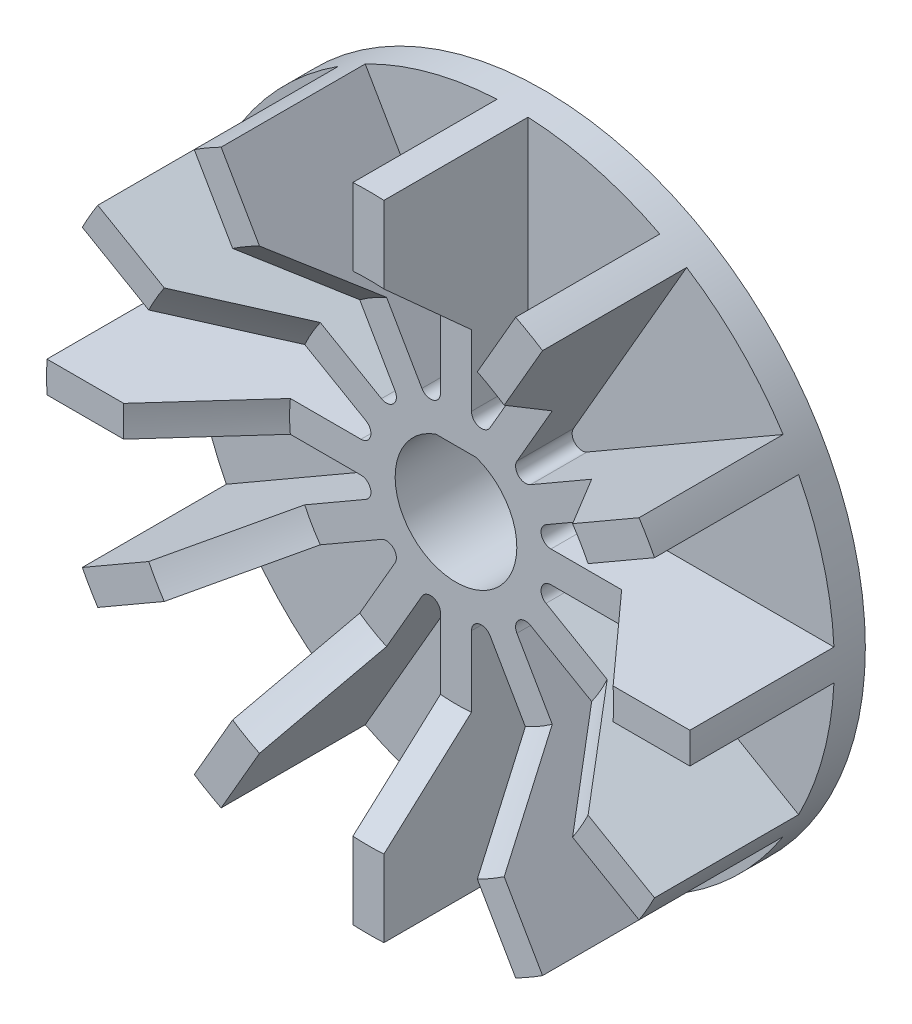
from build123d import *

# Parameters (mm, degrees)
SKETCH1_R           = 46.6725
BOSS_EXTRUDE1_DEPTH = 4.5
BOSS_EXTRUDE2_START = -4.5
BOSS_EXTRUDE2_DEPTH = 25.4


with BuildPart() as part:
    # Sketch1 → Boss-Extrude1 (new body)
    with BuildSketch(Plane.XY):
        Circle(SKETCH1_R)
        with BuildLine():
            Line((-2.927883194, 8.3225), (2.927883194, 8.3225))
            ThreePointArc((2.927883194, 8.3225), (0, -8.8225), (-2.927883194, 8.3225))
        make_face(mode=Mode.SUBTRACT)
    extrude(amount=BOSS_EXTRUDE1_DEPTH)

    # Sketch2 → Boss-Extrude2 (add)
    with BuildSketch(Plane.XY.offset(4.5).offset(BOSS_EXTRUDE2_START)):
        with BuildLine():
            Line((-2.25, 46.618234161), (-2.25, 13.778350254))
            ThreePointArc((-2.25, 13.778350254), (-3.318707206, 12.385583908), (-4.940617969, 13.057401343))
            Line((-4.940617969, 13.057401343), (-21.360559922, 41.497575063))
            ThreePointArc((-21.360559922, 41.497575063), (-23.33625, 40.419570658), (-25.257674239, 39.247575063))
            Line((-25.257674239, 39.247575063), (-8.837732286, 10.807401343))
            ThreePointArc((-8.837732286, 10.807401343), (-9.066876702, 9.066876702), (-10.807401343, 8.837732286))
            Line((-10.807401343, 8.837732286), (-39.247575063, 25.257674239))
            ThreePointArc((-39.247575063, 25.257674239), (-40.419570658, 23.33625), (-41.497575063, 21.360559922))
            Line((-41.497575063, 21.360559922), (-13.057401343, 4.940617969))
            ThreePointArc((-13.057401343, 4.940617969), (-12.385583908, 3.318707206), (-13.778350254, 2.25))
            Line((-13.778350254, 2.25), (-46.618234161, 2.25))
            ThreePointArc((-46.618234161, 2.25), (-46.6725, 0), (-46.618234161, -2.25))
            Line((-46.618234161, -2.25), (-13.778350254, -2.25))
            ThreePointArc((-13.778350254, -2.25), (-12.385583908, -3.318707206), (-13.057401343, -4.940617969))
            Line((-13.057401343, -4.940617969), (-41.497575063, -21.360559922))
            ThreePointArc((-41.497575063, -21.360559922), (-40.419570658, -23.33625), (-39.247575063, -25.257674239))
            Line((-39.247575063, -25.257674239), (-10.807401343, -8.837732286))
            ThreePointArc((-10.807401343, -8.837732286), (-9.066876702, -9.066876702), (-8.837732286, -10.807401343))
            Line((-8.837732286, -10.807401343), (-25.257674239, -39.247575063))
            ThreePointArc((-25.257674239, -39.247575063), (-23.33625, -40.419570658), (-21.360559922, -41.497575063))
            Line((-21.360559922, -41.497575063), (-4.940617969, -13.057401343))
            ThreePointArc((-4.940617969, -13.057401343), (-3.318707206, -12.385583908), (-2.25, -13.778350254))
            Line((-2.25, -13.778350254), (-2.25, -46.618234161))
            ThreePointArc((-2.25, -46.618234161), (0, -46.6725), (2.25, -46.618234161))
            Line((2.25, -46.618234161), (2.25, -13.778350254))
            ThreePointArc((2.25, -13.778350254), (3.318707206, -12.385583908), (4.940617969, -13.057401343))
            Line((4.940617969, -13.057401343), (21.360559922, -41.497575063))
            ThreePointArc((21.360559922, -41.497575063), (23.33625, -40.419570658), (25.257674239, -39.247575063))
            Line((25.257674239, -39.247575063), (8.837732286, -10.807401343))
            ThreePointArc((8.837732286, -10.807401343), (9.066876702, -9.066876702), (10.807401343, -8.837732286))
            Line((10.807401343, -8.837732286), (39.247575063, -25.257674239))
            ThreePointArc((39.247575063, -25.257674239), (40.419570658, -23.33625), (41.497575063, -21.360559922))
            Line((41.497575063, -21.360559922), (13.057401343, -4.940617969))
            ThreePointArc((13.057401343, -4.940617969), (12.385583908, -3.318707206), (13.778350254, -2.25))
            Line((13.778350254, -2.25), (46.618234161, -2.25))
            ThreePointArc((46.618234161, -2.25), (46.6725, 0), (46.618234161, 2.25))
            Line((46.618234161, 2.25), (13.778350254, 2.25))
            ThreePointArc((13.778350254, 2.25), (12.385583908, 3.318707206), (13.057401343, 4.940617969))
            Line((13.057401343, 4.940617969), (41.497575063, 21.360559922))
            ThreePointArc((41.497575063, 21.360559922), (40.419570658, 23.33625), (39.247575063, 25.257674239))
            Line((39.247575063, 25.257674239), (10.807401343, 8.837732286))
            ThreePointArc((10.807401343, 8.837732286), (9.066876702, 9.066876702), (8.837732286, 10.807401343))
            Line((8.837732286, 10.807401343), (25.257674239, 39.247575063))
            ThreePointArc((25.257674239, 39.247575063), (23.33625, 40.419570658), (21.360559922, 41.497575063))
            Line((21.360559922, 41.497575063), (4.940617969, 13.057401343))
            ThreePointArc((4.940617969, 13.057401343), (3.318707206, 12.385583908), (2.25, 13.778350254))
            Line((2.25, 13.778350254), (2.25, 46.618234161))
            ThreePointArc((2.25, 46.618234161), (0, 46.6725), (-2.25, 46.618234161))
        make_face()
        with BuildLine():
            Line((2.927883194, 8.3225), (-2.927883194, 8.3225))
            ThreePointArc((-2.927883194, 8.3225), (0, -8.8225), (2.927883194, 8.3225))
        make_face(mode=Mode.SUBTRACT)
    extrude(amount=BOSS_EXTRUDE2_DEPTH)

    # Sketch3 → Cut-Revolve1 (revolve, cut)
    with BuildSketch(Plane(origin=(0, 0, 0), x_dir=(1, 0, 0), z_dir=(0, 1, 0)), mode=Mode.PRIVATE) as cut_revolve1_sk:
        Polygon((-24.13, -12.7), (-6.35, -12.7), (-6.35, -25.4), (-35.56, -25.4), align=None)
    revolve(cut_revolve1_sk.sketch.rotate(Axis((0, 0, 0), (0, 0, 1)), 2.76320082), axis=Axis((0, 0, 0), (0, 0, 1)), mode=Mode.SUBTRACT)


solid = part.part
